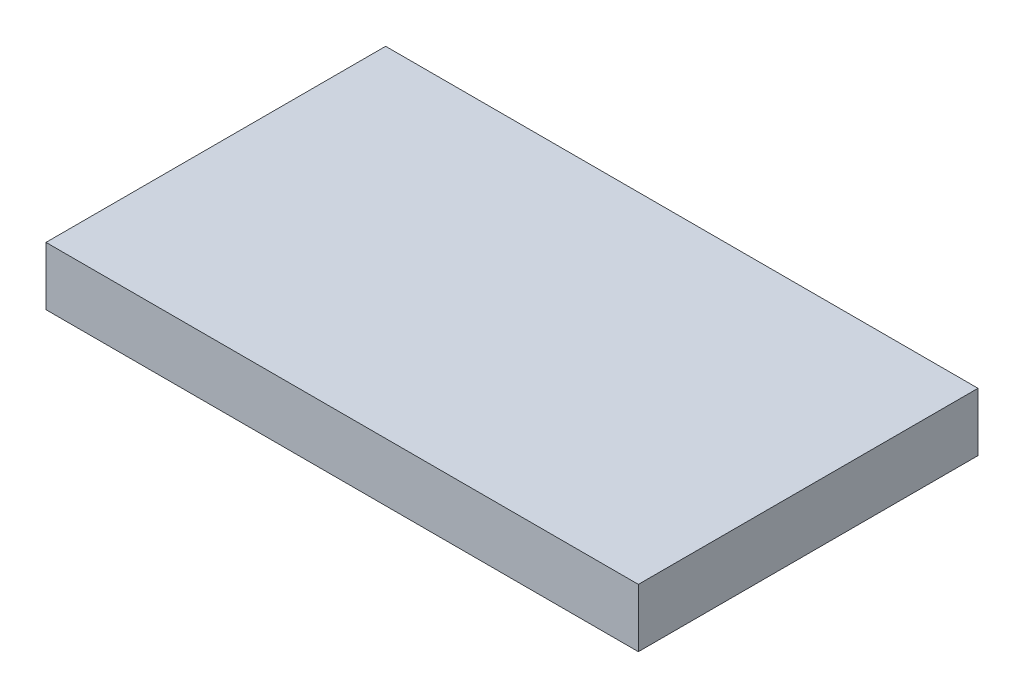
from build123d import *

# Parameters (mm, degrees)
SKETCH_529_W           = 518
SKETCH_529_H           = 297
EXTRUDE_601_DEPTH      = 51
SKETCH_5_3_R           = 30
CUT_EXTRUDE_11_DEPTH   = 10
SKETCH_5_3_2_R         = 22.5
CUT_EXTRUDE_11_2_DEPTH = 25


with BuildPart() as part:
    # Sketch 529 → Extrude 601 (new body)
    with BuildSketch(Plane(origin=(0, 0, 0), x_dir=(1, 0, 0), z_dir=(0, 1, 0))):
        with Locations((184, -92)):
            Rectangle(SKETCH_529_W, SKETCH_529_H)
    extrude(amount=EXTRUDE_601_DEPTH)

    # Sketch 5_3 → Ложемент для КМЕ-11 (cut)
    with BuildSketch(Plane(origin=(0, 0, 0), x_dir=(1, 0, 0), z_dir=(0, 1, 0))):
        with Locations(Location((0, 0, 0), (0, 0, 270))):
            Circle(SKETCH_5_3_R)
        with Locations(Location((92, 0, 0), (0, 0, 270))):
            Circle(SKETCH_5_3_R)
        with Locations(Location((184, 0, 0), (0, 0, 270))):
            Circle(SKETCH_5_3_R)
        with Locations(Location((276, 0, 0), (0, 0, 270))):
            Circle(SKETCH_5_3_R)
        with Locations(Location((368, 0, 0), (0, 0, 270))):
            Circle(SKETCH_5_3_R)
        with Locations(Location((0, -92, 0), (0, 0, 270))):
            Circle(SKETCH_5_3_R)
        with Locations(Location((92, -92, 0), (0, 0, 270))):
            Circle(SKETCH_5_3_R)
        with Locations(Location((184, -92, 0), (0, 0, 270))):
            Circle(SKETCH_5_3_R)
        with Locations(Location((276, -92, 0), (0, 0, 270))):
            Circle(SKETCH_5_3_R)
        with Locations(Location((368, -92, 0), (0, 0, 270))):
            Circle(SKETCH_5_3_R)
        with Locations(Location((0, -184, 0), (0, 0, 270))):
            Circle(SKETCH_5_3_R)
        with Locations(Location((92, -184, 0), (0, 0, 270))):
            Circle(SKETCH_5_3_R)
        with Locations(Location((184, -184, 0), (0, 0, 270))):
            Circle(SKETCH_5_3_R)
        with Locations(Location((276, -184, 0), (0, 0, 270))):
            Circle(SKETCH_5_3_R)
        with Locations(Location((368, -184, 0), (0, 0, 270))):
            Circle(SKETCH_5_3_R)
    extrude(amount=CUT_EXTRUDE_11_DEPTH, mode=Mode.SUBTRACT)

    # Sketch 5_3 2 → Ложемент для КМЕ-11 (2) (cut)
    with BuildSketch(Plane.XZ):
        with Locations(Location((0, 0, 0), (0, 0, 270))):
            Circle(SKETCH_5_3_2_R)
        with Locations(Location((92, 0, 0), (0, 0, 270))):
            Circle(SKETCH_5_3_2_R)
        with Locations(Location((184, 0, 0), (0, 0, 270))):
            Circle(SKETCH_5_3_2_R)
        with Locations(Location((276, 0, 0), (0, 0, 270))):
            Circle(SKETCH_5_3_2_R)
        with Locations(Location((368, 0, 0), (0, 0, 270))):
            Circle(SKETCH_5_3_2_R)
        with Locations(Location((92, 92, 0), (0, 0, 270))):
            Circle(SKETCH_5_3_2_R)
        with Locations(Location((184, 92, 0), (0, 0, 270))):
            Circle(SKETCH_5_3_2_R)
        with Locations(Location((276, 92, 0), (0, 0, 270))):
            Circle(SKETCH_5_3_2_R)
        with Locations(Location((368, 92, 0), (0, 0, 270))):
            Circle(SKETCH_5_3_2_R)
        with Locations(Location((92, 184, 0), (0, 0, 270))):
            Circle(SKETCH_5_3_2_R)
        with Locations(Location((184, 184, 0), (0, 0, 270))):
            Circle(SKETCH_5_3_2_R)
        with Locations(Location((276, 184, 0), (0, 0, 270))):
            Circle(SKETCH_5_3_2_R)
        with Locations(Location((368, 184, 0), (0, 0, 270))):
            Circle(SKETCH_5_3_2_R)
        with Locations(Location((0, 92, 0), (0, 0, 270))):
            Circle(SKETCH_5_3_2_R)
        with Locations(Location((0, 184, 0), (0, 0, 270))):
            Circle(SKETCH_5_3_2_R)
    extrude(amount=-CUT_EXTRUDE_11_2_DEPTH, mode=Mode.SUBTRACT)


solid = part.part
